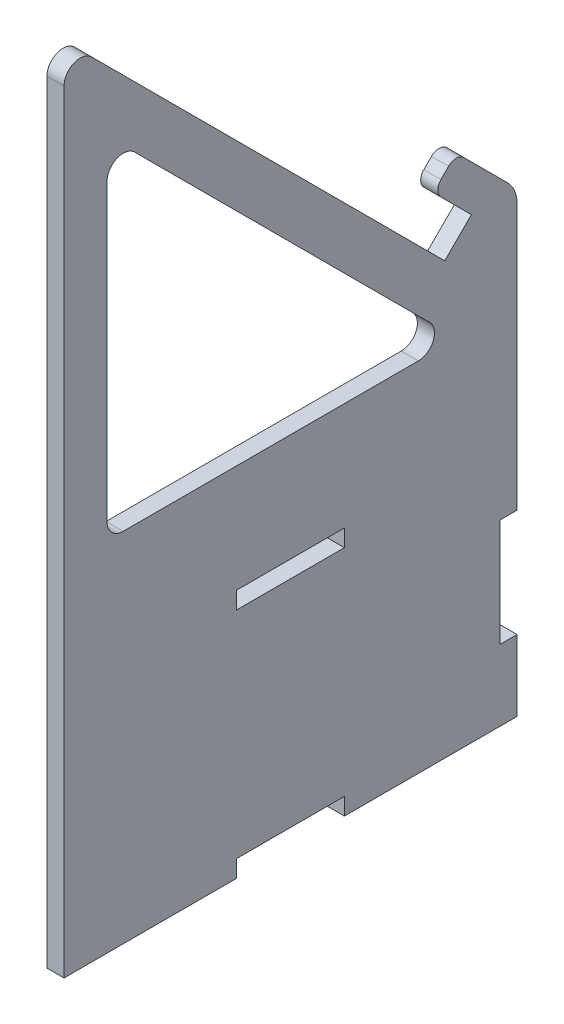
from build123d import *

# Parameters (mm, degrees)
BOSS_EXTRU_1_DEPTH      = 3.175
ESQUISSE2_W             = 20
ESQUISSE2_H             = 3.175
ESQUISSE2_W_2           = 3.175
ESQUISSE2_H_2           = 20
ENL_V_MAT_EXTRU_1_DEPTH = 157.5053166
CONG_1_R                = 6
CONG_2_R                = 2
ENL_V_MAT_EXTRU_2_DEPTH = 157.5053166
CONG_4_R                = 3


with BuildPart() as part:
    # Esquisse1 → Boss.-Extru.1 (new body)
    with BuildSketch(Plane(origin=(0, 0, 0), x_dir=(0, 0, -1), z_dir=(1, 0, 0))):
        Polygon((-42.072853481, 0), (42.072853481, 0), (42.072853481, 84.949747468), (30.759144982, 96.263455967), (26.516504294, 92.02081528), (33.587572106, 84.949747468), (28.637824638, 80), (-42.072853481, 150.710678119), align=None)
    extrude(amount=BOSS_EXTRU_1_DEPTH)

    # Esquisse2 → Enlèv. mat.-Extru.1 (cut, through all)
    with BuildSketch(Plane(origin=(3.175, 0, 0), x_dir=(0, 0, -1), z_dir=(1, 0, 0))):
        with Locations((0, 1.5875)):
            Rectangle(ESQUISSE2_W, ESQUISSE2_H)
        with Locations((0, 44.7625)):
            Rectangle(ESQUISSE2_W, ESQUISSE2_H)
        with Locations((40.485353481, 23.175)):
            Rectangle(ESQUISSE2_W_2, ESQUISSE2_H_2)
    extrude(amount=-ENL_V_MAT_EXTRU_1_DEPTH, mode=Mode.SUBTRACT)

    # Congé1
    cong_1_edges = [part.edges().sort_by_distance(p)[0] for p in [
        (1.5875, 84.949747468, -42.072853481),
    ]]
    fillet(cong_1_edges, radius=CONG_1_R)

    # Congé2
    cong_2_edges = [part.edges().sort_by_distance(p)[0] for p in [
        (1.5875, 92.02081528, -26.516504294),
        (1.5875, 96.263455967, -30.759144982),
    ]]
    fillet(cong_2_edges, radius=CONG_2_R)

    # Esquisse4 → Enlèv. mat.-Extru.2 (cut, through all)
    with BuildSketch(Plane(origin=(3.175, 0, 0), x_dir=(0, 0, -1), z_dir=(1, 0, 0))):
        Polygon((30.974116139, 66.35), (-34.072853481, 66.35), (-34.072853481, 131.39696962), align=None)
    extrude(amount=-ENL_V_MAT_EXTRU_2_DEPTH, mode=Mode.SUBTRACT)

    # Congé4
    cong_4_edges = [part.edges().sort_by_distance(p)[0] for p in [
        (1.5875, 150.710678119, 42.072853481),
        (1.5875, 131.39696962, 34.072853481),
        (1.5875, 66.35, -30.974116139),
        (1.5875, 66.35, 34.072853481),
    ]]
    fillet(cong_4_edges, radius=CONG_4_R)


solid = part.part
